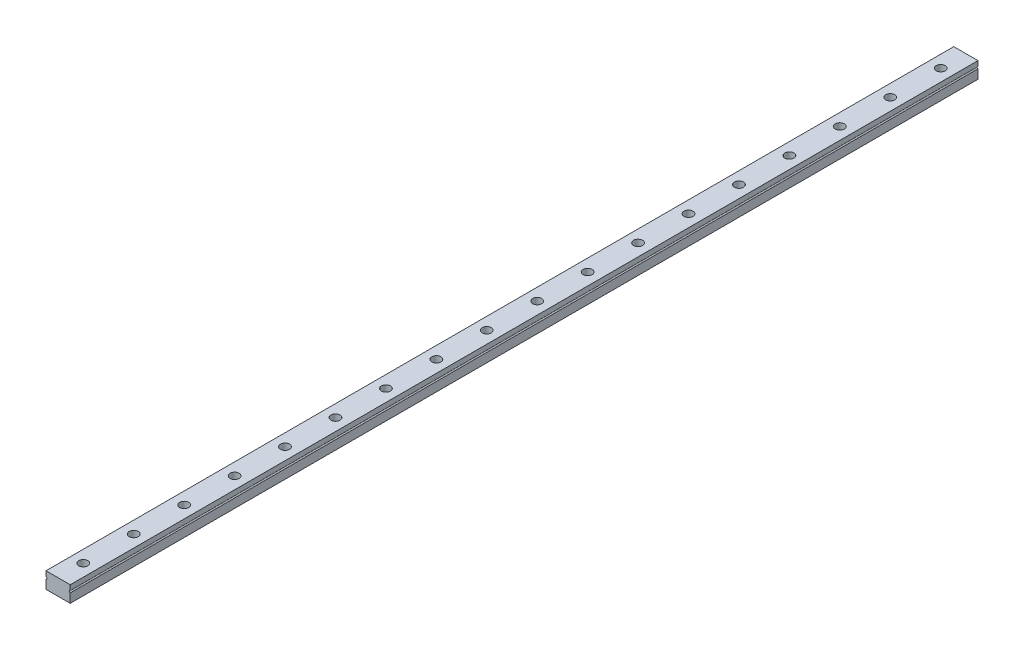
from build123d import *

# Parameters (mm, degrees)
BOSS_EXTRUDE1_DEPTH              = 450
RAILHOLES_SKETCH1_R              = 1.75
RAILHOLES_CUT_EXTRUDE1_DEPTH     = 451.231051795
RAILBOREHOLES_SKETCH2_R          = 2.25
RAILBOREHOLES_CUT_EXTRUDE2_DEPTH = 4


with BuildPart() as part:
    # Rail-Sketch1 → Boss-Extrude1 (new body)
    with BuildSketch(Plane.XY):
        with BuildLine():
            Line((0, 0), (12, 0))
            Line((12, 0), (12, 4.499999912))
            ThreePointArc((12, 4.499999912), (11.500000044, 4.999999956), (12, 5.5))
            Line((12, 5.5), (12, 8))
            Line((12, 8), (0, 8))
            Line((0, 8), (0, 5.5))
            ThreePointArc((0, 5.5), (0.500000044, 4.999999956), (0, 4.499999912))
            Line((0, 4.499999912), (0, 0))
        make_face()
    extrude(amount=BOSS_EXTRUDE1_DEPTH)

    # RailHoles-Sketch1 → RailHoles-Cut-Extrude1 (cut, through all)
    with BuildSketch(Plane(origin=(0, 8, 0), x_dir=(1, 0, 0), z_dir=(0, 1, 0))):
        with Locations(Location((6, -437.5, 0), (0, 0, 270))):
            Circle(RAILHOLES_SKETCH1_R)
        with Locations(Location((6, -412.5, 0), (0, 0, 270))):
            Circle(RAILHOLES_SKETCH1_R)
        with Locations(Location((6, -387.5, 0), (0, 0, 270))):
            Circle(RAILHOLES_SKETCH1_R)
        with Locations(Location((6, -362.5, 0), (0, 0, 270))):
            Circle(RAILHOLES_SKETCH1_R)
        with Locations(Location((6, -337.5, 0), (0, 0, 270))):
            Circle(RAILHOLES_SKETCH1_R)
        with Locations(Location((6, -312.5, 0), (0, 0, 270))):
            Circle(RAILHOLES_SKETCH1_R)
        with Locations(Location((6, -287.5, 0), (0, 0, 270))):
            Circle(RAILHOLES_SKETCH1_R)
        with Locations(Location((6, -262.5, 0), (0, 0, 270))):
            Circle(RAILHOLES_SKETCH1_R)
        with Locations(Location((6, -237.5, 0), (0, 0, 270))):
            Circle(RAILHOLES_SKETCH1_R)
        with Locations(Location((6, -212.5, 0), (0, 0, 270))):
            Circle(RAILHOLES_SKETCH1_R)
        with Locations(Location((6, -187.5, 0), (0, 0, 270))):
            Circle(RAILHOLES_SKETCH1_R)
        with Locations(Location((6, -162.5, 0), (0, 0, 270))):
            Circle(RAILHOLES_SKETCH1_R)
        with Locations(Location((6, -137.5, 0), (0, 0, 270))):
            Circle(RAILHOLES_SKETCH1_R)
        with Locations(Location((6, -112.5, 0), (0, 0, 270))):
            Circle(RAILHOLES_SKETCH1_R)
        with Locations(Location((6, -87.5, 0), (0, 0, 270))):
            Circle(RAILHOLES_SKETCH1_R)
        with Locations(Location((6, -62.5, 0), (0, 0, 270))):
            Circle(RAILHOLES_SKETCH1_R)
        with Locations(Location((6, -37.5, 0), (0, 0, 270))):
            Circle(RAILHOLES_SKETCH1_R)
        with Locations(Location((6, -12.5, 0), (0, 0, 270))):
            Circle(RAILHOLES_SKETCH1_R)
    extrude(amount=-RAILHOLES_CUT_EXTRUDE1_DEPTH, mode=Mode.SUBTRACT)

    # RailBoreHoles-Sketch2 → RailBoreHoles-Cut-Extrude2 (cut)
    with BuildSketch(Plane(origin=(0, 8, 0), x_dir=(1, 0, 0), z_dir=(0, 1, 0))):
        with Locations(Location((6, -437.5, 0), (0, 0, 270))):
            Circle(RAILBOREHOLES_SKETCH2_R)
        with Locations(Location((6, -87.5, 0), (0, 0, 270))):
            Circle(RAILBOREHOLES_SKETCH2_R)
        with Locations(Location((6, -412.5, 0), (0, 0, 270))):
            Circle(RAILBOREHOLES_SKETCH2_R)
        with Locations(Location((6, -387.5, 0), (0, 0, 270))):
            Circle(RAILBOREHOLES_SKETCH2_R)
        with Locations(Location((6, -362.5, 0), (0, 0, 270))):
            Circle(RAILBOREHOLES_SKETCH2_R)
        with Locations(Location((6, -337.5, 0), (0, 0, 270))):
            Circle(RAILBOREHOLES_SKETCH2_R)
        with Locations(Location((6, -312.5, 0), (0, 0, 270))):
            Circle(RAILBOREHOLES_SKETCH2_R)
        with Locations(Location((6, -287.5, 0), (0, 0, 270))):
            Circle(RAILBOREHOLES_SKETCH2_R)
        with Locations(Location((6, -262.5, 0), (0, 0, 270))):
            Circle(RAILBOREHOLES_SKETCH2_R)
        with Locations(Location((6, -237.5, 0), (0, 0, 270))):
            Circle(RAILBOREHOLES_SKETCH2_R)
        with Locations(Location((6, -212.5, 0), (0, 0, 270))):
            Circle(RAILBOREHOLES_SKETCH2_R)
        with Locations(Location((6, -187.5, 0), (0, 0, 270))):
            Circle(RAILBOREHOLES_SKETCH2_R)
        with Locations(Location((6, -162.5, 0), (0, 0, 270))):
            Circle(RAILBOREHOLES_SKETCH2_R)
        with Locations(Location((6, -137.5, 0), (0, 0, 270))):
            Circle(RAILBOREHOLES_SKETCH2_R)
        with Locations(Location((6, -112.5, 0), (0, 0, 270))):
            Circle(RAILBOREHOLES_SKETCH2_R)
        with Locations(Location((6, -62.5, 0), (0, 0, 270))):
            Circle(RAILBOREHOLES_SKETCH2_R)
        with Locations(Location((6, -37.5, 0), (0, 0, 270))):
            Circle(RAILBOREHOLES_SKETCH2_R)
        with Locations(Location((6, -12.5, 0), (0, 0, 270))):
            Circle(RAILBOREHOLES_SKETCH2_R)
    extrude(amount=-RAILBOREHOLES_CUT_EXTRUDE2_DEPTH, mode=Mode.SUBTRACT)


solid = part.part
